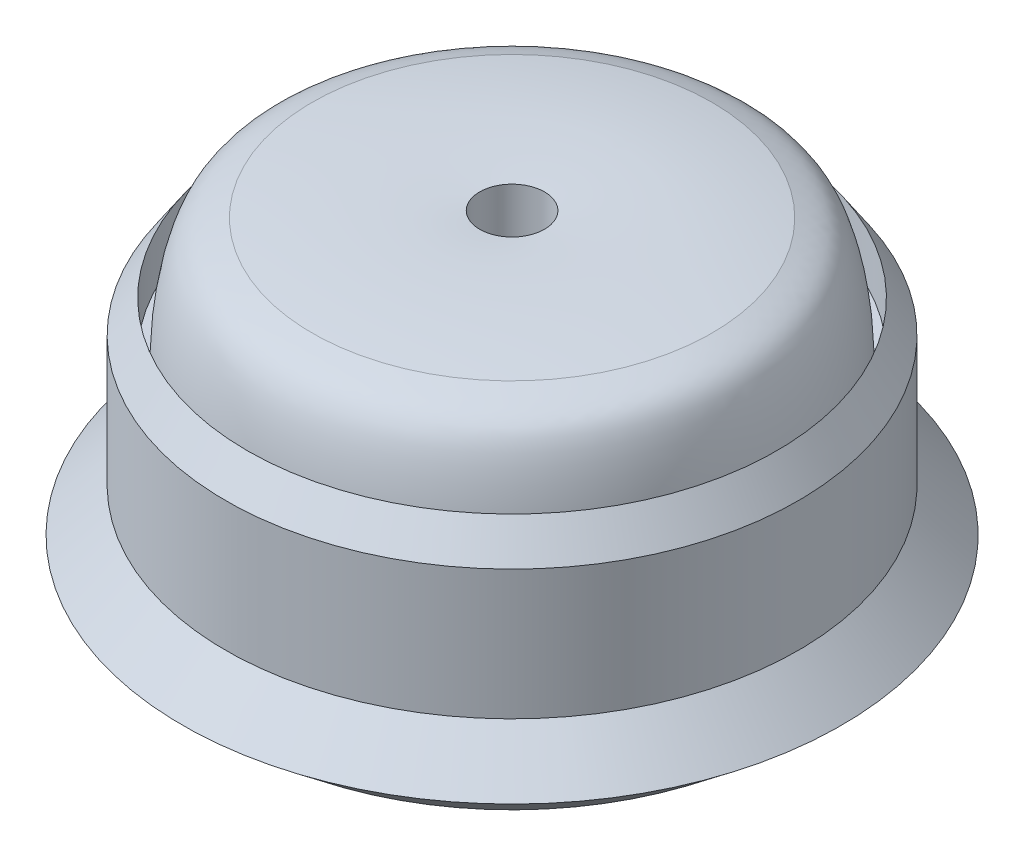
from build123d import *


with BuildPart() as part:
    # 草图1 → 旋转1 (revolve)
    with BuildSketch(Plane.XY, mode=Mode.PRIVATE) as revolve_1_sk:
        with BuildLine():
            add(Edge.make_bspline(
                [(3, 30), (10.804022891, 30.629123292), (18.5, 29.429304071)],
                knots=[0, 0, 0, 1, 1, 1], degree=2))
            Line((3, 30), (3, 25.264976959))
            Line((3, 25.264976959), (5.5, 25.264976959))
            Line((5.5, 25.264976959), (5.5, 28))
            Line((5.5, 28), (18.5, 28))
            Line((18.5, 28), (18.5, 17))
            Line((18.5, 17), (22.5, 17))
            Line((22.5, 17), (22.5, 0))
            Line((22.5, 0), (25.5, 0))
            Line((25.5, 0), (30.5, 4))
            Line((30.5, 4), (26.5, 8))
            Line((26.5, 8), (26.5, 20))
            Line((26.5, 20), (24.5, 23))
            Line((24.5, 23), (24.5, 18.421658986))
            Line((24.5, 18.421658986), (23.7, 18.421658986))
            add(Edge.make_bspline(
                [(18.5, 29.429304071), (20.511937278, 28.706105263), (22.57806562, 27.932491859), (23.627012252, 21.580564191), (23.7, 18.421658986)],
                knots=[0, 0, 0, 0, 0.382453264, 0.927890023, 0.927890023, 0.927890023, 0.927890023], degree=3))
        make_face()
    revolve(revolve_1_sk.sketch.rotate(Axis((0, 0, 0), (0, 1, 0)), 90), axis=Axis((0, 0, 0), (0, 1, 0)))


solid = part.part
